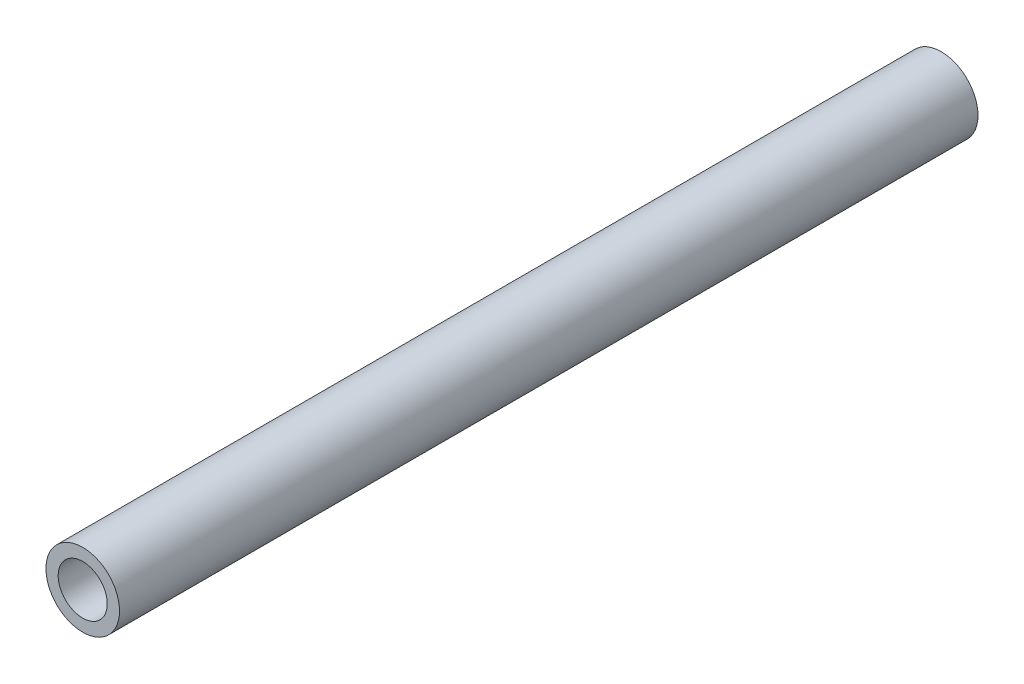
from build123d import *

# Parameters (mm, degrees)
SKETCH1_R           = 1.5
SKETCH1_R_2         = 1
BOSS_EXTRUDE1_DEPTH = 35


with BuildPart() as part:
    # Sketch1 → Boss-Extrude1 (new body)
    with BuildSketch(Plane.XY):
        with Locations((-0.992203806, 0.011518033)):
            Circle(SKETCH1_R)
        with Locations((-0.992203806, 0.011518033)):
            Circle(SKETCH1_R_2, mode=Mode.SUBTRACT)
    extrude(amount=BOSS_EXTRUDE1_DEPTH)


solid = part.part
